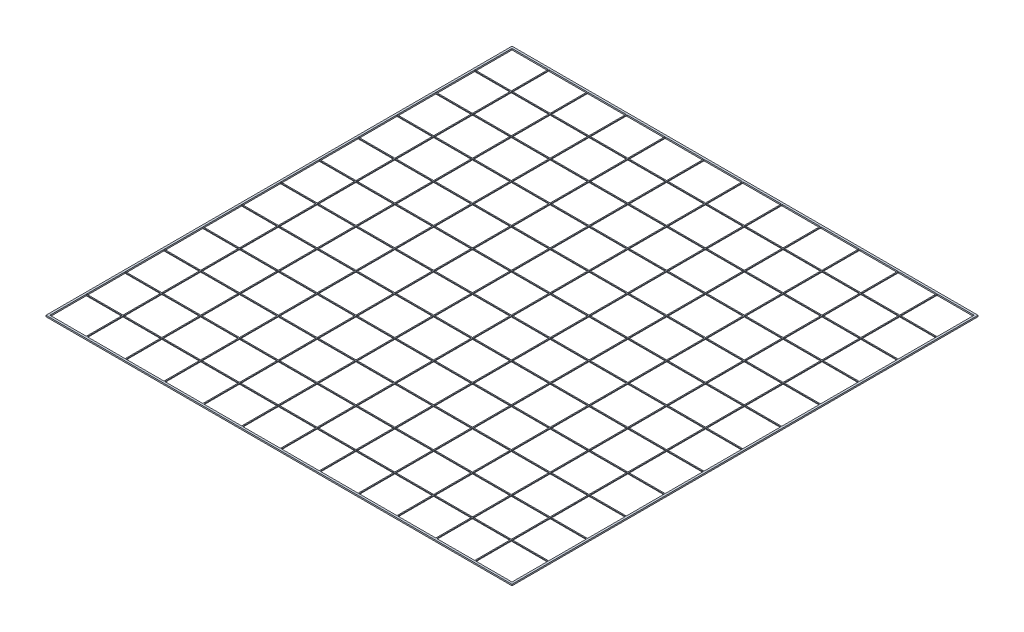
from build123d import *

# Parameters (mm, degrees)
SKETCH1_W           = 190
SKETCH1_H           = 190
SKETCH1_W_2         = 188.4
SKETCH1_H_2         = 188.4
BOSS_EXTRUDE1_DEPTH = 0.28
SKETCH2_W           = 0.4
SKETCH2_H           = 190
BOSS_EXTRUDE2_DEPTH = 0.28
LPATTERN1_COUNT     = 11
LPATTERN1_PITCH     = 15.833333333
SKETCH3_W           = 190
SKETCH3_H           = 0.4
BOSS_EXTRUDE3_DEPTH = 0.28
LPATTERN2_COUNT     = 11
LPATTERN2_PITCH     = 15.833333333


with BuildPart() as part:
    # Sketch1 → Boss-Extrude1 (new, symmetric)
    with BuildSketch(Plane(origin=(0, 0, 0), x_dir=(1, 0, 0), z_dir=(0, 1, 0))):
        Rectangle(SKETCH1_W, SKETCH1_H)
        Rectangle(SKETCH1_W_2, SKETCH1_H_2, mode=Mode.SUBTRACT)
    extrude(amount=BOSS_EXTRUDE1_DEPTH, both=True)

    # Sketch2 → Boss-Extrude2 (add)
    with BuildSketch(Plane(origin=(0, 0, 0), x_dir=(1, 0, 0), z_dir=(0, 1, 0))):
        with Locations((-79.166666667, 0)):
            Rectangle(SKETCH2_W, SKETCH2_H)
    boss_extrude2 = extrude(amount=BOSS_EXTRUDE2_DEPTH)

    # LPattern1: Boss-Extrude2 ×11
    with Locations(*[(i * LPATTERN1_PITCH, 0, 0) for i in range(1, LPATTERN1_COUNT)]):
        add(boss_extrude2)

    # Sketch3 → Boss-Extrude3 (add)
    with BuildSketch(Plane(origin=(0, 0, 0), x_dir=(1, 0, 0), z_dir=(0, 1, 0))):
        with Locations((0, 79.166666667)):
            Rectangle(SKETCH3_W, SKETCH3_H)
    boss_extrude3 = extrude(amount=-BOSS_EXTRUDE3_DEPTH)

    # LPattern2: Boss-Extrude3 ×11
    with Locations(*[(0, 0, i * LPATTERN2_PITCH) for i in range(1, LPATTERN2_COUNT)]):
        add(boss_extrude3)


solid = part.part
